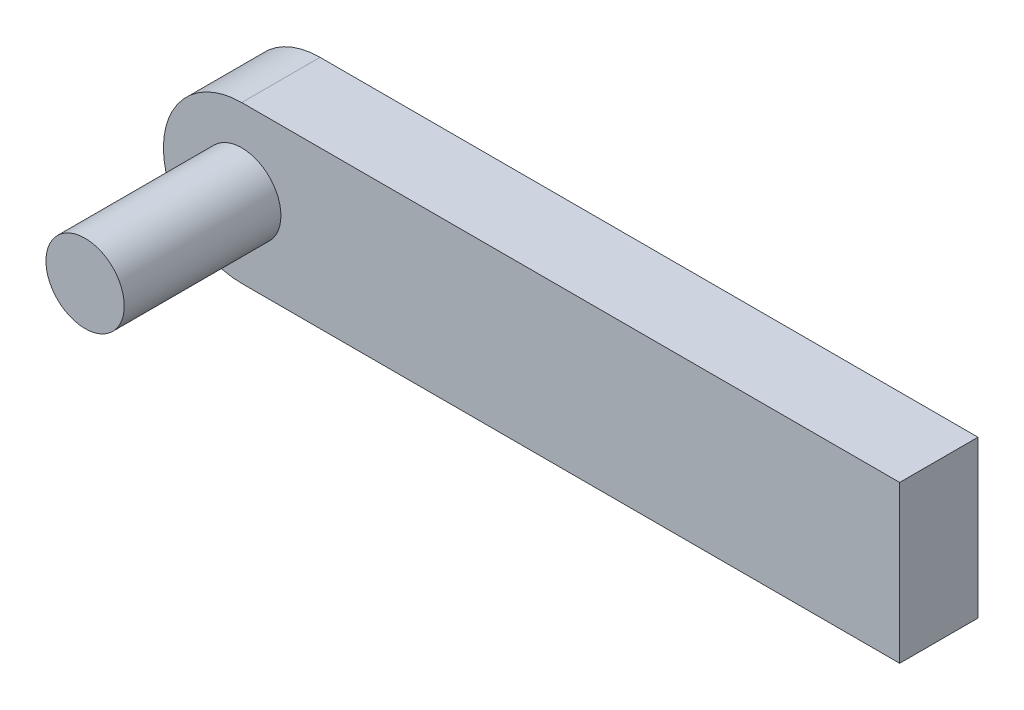
from build123d import *

# Parameters (mm, degrees)
SKETCH1_R                = 2.5
BOSS_EXTRUDE1_DEPTH      = 10
SKETCH2_R                = 5
BOSS_EXTRUDE2_DEPTH      = 5
BOSS_EXTRUDE3_REACH      = 20.708
BOSS_EXTRUDE3_END_RADIUS = 5
SKETCH4_W                = 5
SKETCH4_H                = 10
SKETCH5_W                = 5
SKETCH5_H                = 10
BOSS_EXTRUDE4_DEPTH      = 32


with BuildPart() as part:
    # Sketch1 → Boss-Extrude1 (new body)
    with BuildSketch(Plane.XY):
        Circle(SKETCH1_R)
    extrude(amount=BOSS_EXTRUDE1_DEPTH)

    # Sketch2 → Boss-Extrude2 (add)
    with BuildSketch(Plane(origin=(0, 0, 0), x_dir=(-1, 0, 0), z_dir=(0, 0, -1))):
        Circle(SKETCH2_R)
    extrude(amount=BOSS_EXTRUDE2_DEPTH)

    # Boss-Extrude3: up to this cylinder (the profile starts outside it)
    boss_extrude3_end = Plane(origin=(0, 0, -2.5), z_dir=(0, 0, 1)) * Cylinder(BOSS_EXTRUDE3_END_RADIUS, 52.416, mode=Mode.PRIVATE)
    # Sketch4 → Boss-Extrude3 (add, up to the surface)
    with BuildSketch(Plane(origin=(10, 0, 0), x_dir=(0, 0, -1), z_dir=(1, 0, 0)), mode=Mode.PRIVATE) as boss_extrude3_sk1:
        with Locations((2.5, 0)):
            Rectangle(SKETCH4_W, SKETCH4_H)
    boss_extrude3_tool1 = extrude(boss_extrude3_sk1.sketch, amount=-BOSS_EXTRUDE3_REACH, mode=Mode.PRIVATE) - boss_extrude3_end
    add(boss_extrude3_tool1.solids().sort_by_distance((10, 0, -2.5))[0])

    # Sketch5 → Boss-Extrude4 (add)
    with BuildSketch(Plane(origin=(10, 0, 0), x_dir=(0, 0, -1), z_dir=(1, 0, 0))):
        with Locations((2.5, 0)):
            Rectangle(SKETCH5_W, SKETCH5_H)
    extrude(amount=BOSS_EXTRUDE4_DEPTH)


solid = part.part
